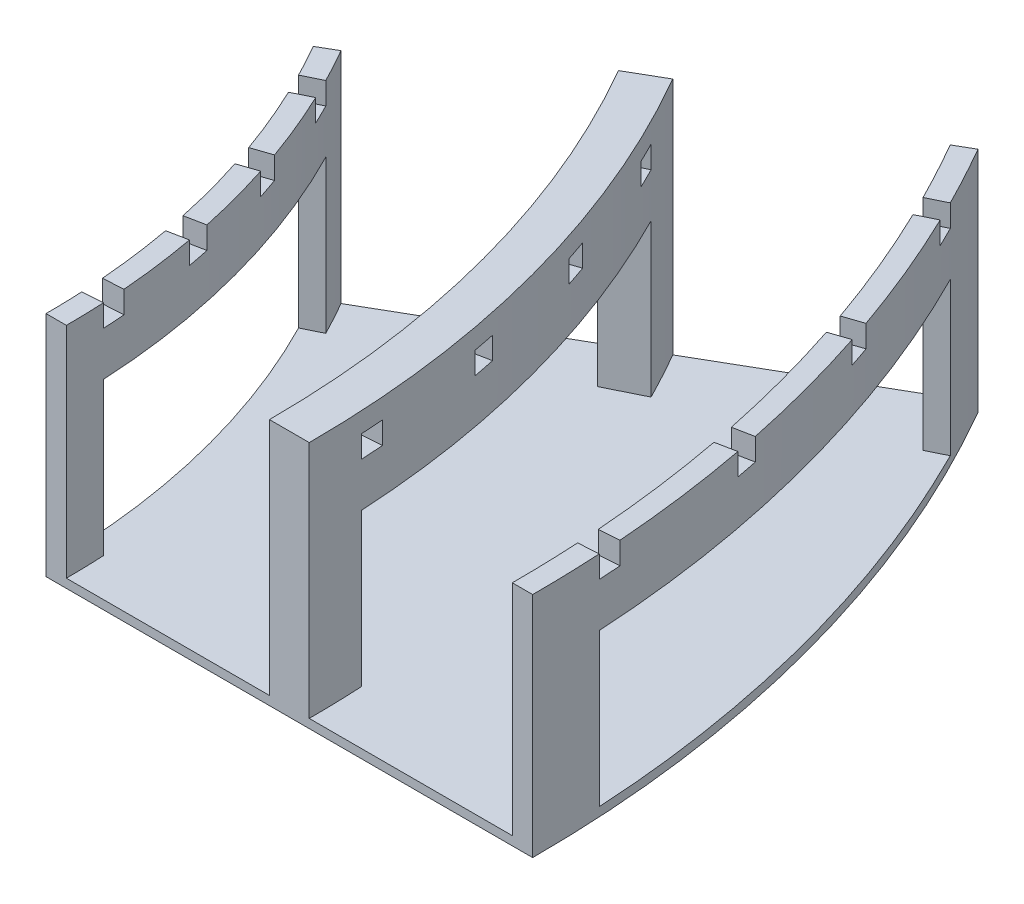
from build123d import *

# Parameters (mm, degrees)
AUFSATZ_LINEAR_AUSTRAGEN1_DEPTH   = 51.5
AUFSATZ_LINEAR_AUSTRAGEN1_2_DEPTH = 51.5
AUFSATZ_LINEAR_AUSTRAGEN1_3_DEPTH = 51.5
SCHNITT_LINEAR_START              = -5
SCHNITT_LINEAR_AUSTRAGEN1_DEPTH   = 5
AUFSATZ_LINEAR_AUSTRAGEN2_DEPTH   = 2
SCHNITT_LINEAR_START_2            = -49.5
SCHNITT_LINEAR_AUSTRAGEN2_DEPTH   = 34.5
AUFSATZ_LINEAR_AUSTRAGEN3_DEPTH   = 4.5


with BuildPart() as part:
    # Skizze1 → Aufsatz-Linear austragen1 (new body)
    with BuildSketch(Plane(origin=(0, 0, 0), x_dir=(1, 0, 0), z_dir=(0, 1, 0))):
        with BuildLine():
            Line((165, 0), (169.6, 0))
            ThreePointArc((169.6, 0), (163.821020139, 43.895710049), (146.877908482, 84.8))
            Line((146.877908482, 84.8), (142.894191624, 82.5))
            ThreePointArc((142.894191624, 82.5), (159.377761338, 42.705142442), (165, 0))
        make_face()
    extrude(amount=AUFSATZ_LINEAR_AUSTRAGEN1_DEPTH)


with BuildPart() as body_2:
    # Skizze1 → Aufsatz-Linear austragen1 2 (new body)
    with BuildSketch(Plane(origin=(0, 0, 0), x_dir=(1, 0, 0), z_dir=(0, 1, 0))):
        with BuildLine():
            Line((215.5, 0), (224.5, 0))
            ThreePointArc((224.5, 0), (216.850348002, 58.104875626), (194.42270315, 112.25))
            Line((194.42270315, 112.25), (186.628474516, 107.75))
            ThreePointArc((186.628474516, 107.75), (208.157015565, 55.77550422), (215.5, 0))
        make_face()
    extrude(amount=AUFSATZ_LINEAR_AUSTRAGEN1_2_DEPTH)


with BuildPart() as body_3:
    # Skizze1 → Aufsatz-Linear austragen1 3 (new body)
    with BuildSketch(Plane(origin=(0, 0, 0), x_dir=(1, 0, 0), z_dir=(0, 1, 0))):
        with BuildLine():
            Line((234.173269183, 135.2), (238.156986041, 137.5))
            ThreePointArc((238.156986041, 137.5), (265.629602229, 71.175237403), (275, 0))
            Line((275, 0), (270.4, 0))
            ThreePointArc((270.4, 0), (261.186343429, 69.984669796), (234.173269183, 135.2))
        make_face()
    extrude(amount=AUFSATZ_LINEAR_AUSTRAGEN1_3_DEPTH)


with BuildPart() as schnitt_linear_austragen1_tool:
    # Skizze2 → Schnitt-Linear austragen1 (new body)
    with BuildSketch(Plane(origin=(0, 51.5, 0), x_dir=(1, 0, 0), z_dir=(0, 1, 0)).offset(SCHNITT_LINEAR_START)):
        with BuildLine():
            Line((164.464314583, 13.284924864), (274.236356527, 20.479764614))
            ThreePointArc((274.236356527, 20.479764614), (274.411203891, 17.985860538), (274.563372173, 15.490469997))
            Line((274.563372173, 15.490469997), (164.791330229, 8.295630248))
            ThreePointArc((164.791330229, 8.295630248), (164.646722334, 10.791516323), (164.464314583, 13.284924864))
        make_face()
        with BuildLine():
            Line((161.323268916, 34.638171229), (269.217080788, 56.099584774))
            ThreePointArc((269.217080788, 56.099584774), (269.715952111, 53.649838554), (270.192532398, 51.195658372))
            Line((270.192532398, 51.195658372), (162.298720527, 29.734244827))
            ThreePointArc((162.298720527, 29.734244827), (161.829571267, 32.189903133), (161.323268916, 34.638171229))
        make_face()
        with BuildLine():
            Line((157.029134718, 50.664098233), (261.198623482, 86.024874838))
            ThreePointArc((261.198623482, 86.024874838), (260.405785611, 88.395852958), (259.591426156, 90.759525485))
            Line((259.591426156, 90.759525485), (155.421937391, 55.398748881))
            ThreePointArc((155.421937391, 55.398748881), (156.243471367, 53.037511775), (157.029134718, 50.664098233))
        make_face()
        with BuildLine():
            Line((149.072736877, 70.727074872), (247.735533701, 119.382181845))
            ThreePointArc((247.735533701, 119.382181845), (246.640003921, 121.62938981), (245.52409025, 123.866545552))
            Line((245.52409025, 123.866545552), (146.861293426, 75.211438579))
            ThreePointArc((146.861293426, 75.211438579), (147.984002353, 72.977633886), (149.072736877, 70.727074872))
        make_face()
    extrude(amount=SCHNITT_LINEAR_AUSTRAGEN1_DEPTH)


with BuildPart() as part_1:
    add(part.part)

    # Schnitt-Linear austragen1: cut by schnitt_linear_austragen1_tool
    add(schnitt_linear_austragen1_tool.part, mode=Mode.SUBTRACT)



with BuildPart() as body_2_1:
    add(body_2.part)

    # Schnitt-Linear austragen1: cut by schnitt_linear_austragen1_tool
    add(schnitt_linear_austragen1_tool.part, mode=Mode.SUBTRACT)


with BuildPart() as body_3_1:
    add(body_3.part)

    # Schnitt-Linear austragen1: cut by schnitt_linear_austragen1_tool
    add(schnitt_linear_austragen1_tool.part, mode=Mode.SUBTRACT)


with BuildPart() as part_2:
    add(part_1.part)

    add(body_2_1.part)  # Aufsatz-Linear austragen2 merges body 2

    add(body_3_1.part)  # Aufsatz-Linear austragen2 merges body 3
    # Skizze4 → Aufsatz-Linear austragen2 (add)
    with BuildSketch(Plane.XZ):
        with BuildLine():
            Line((165, 0), (275, 0))
            ThreePointArc((275, 0), (265.629602229, -71.175237403), (238.156986041, -137.5))
            Line((238.156986041, -137.5), (142.894191624, -82.5))
            ThreePointArc((142.894191624, -82.5), (159.377761338, -42.705142442), (165, 0))
        make_face()
    extrude(amount=-AUFSATZ_LINEAR_AUSTRAGEN2_DEPTH)

    # Skizze5 → Schnitt-Linear austragen2 (cut)
    with BuildSketch(Plane(origin=(0, 51.5, 0), x_dir=(1, 0, 0), z_dir=(0, 1, 0)).offset(SCHNITT_LINEAR_START_2)):
        with BuildLine():
            Line((164.791330229, 8.295630248), (274.563372173, 15.490469997))
            ThreePointArc((274.563372173, 15.490469997), (265.629602229, 71.175237403), (245.52409025, 123.866545552))
            Line((245.52409025, 123.866545552), (146.861293426, 75.211438579))
            ThreePointArc((146.861293426, 75.211438579), (159.377761338, 42.705142442), (164.791330229, 8.295630248))
        make_face()
    extrude(amount=SCHNITT_LINEAR_AUSTRAGEN2_DEPTH, mode=Mode.SUBTRACT)

    # Skizze6 → Aufsatz-Linear austragen3 (add)
    with BuildSketch(Plane(origin=(0, 51.5, 0), x_dir=(1, 0, 0), z_dir=(0, 1, 0))):
        with BuildLine():
            Line((186.628474516, 107.75), (194.42270315, 112.25))
            ThreePointArc((194.42270315, 112.25), (216.850348002, 58.104875626), (224.5, 0))
            Line((224.5, 0), (215.5, 0))
            ThreePointArc((215.5, 0), (208.157015565, 55.77550422), (186.628474516, 107.75))
        make_face()
    extrude(amount=AUFSATZ_LINEAR_AUSTRAGEN3_DEPTH)


solid = part_2.part
